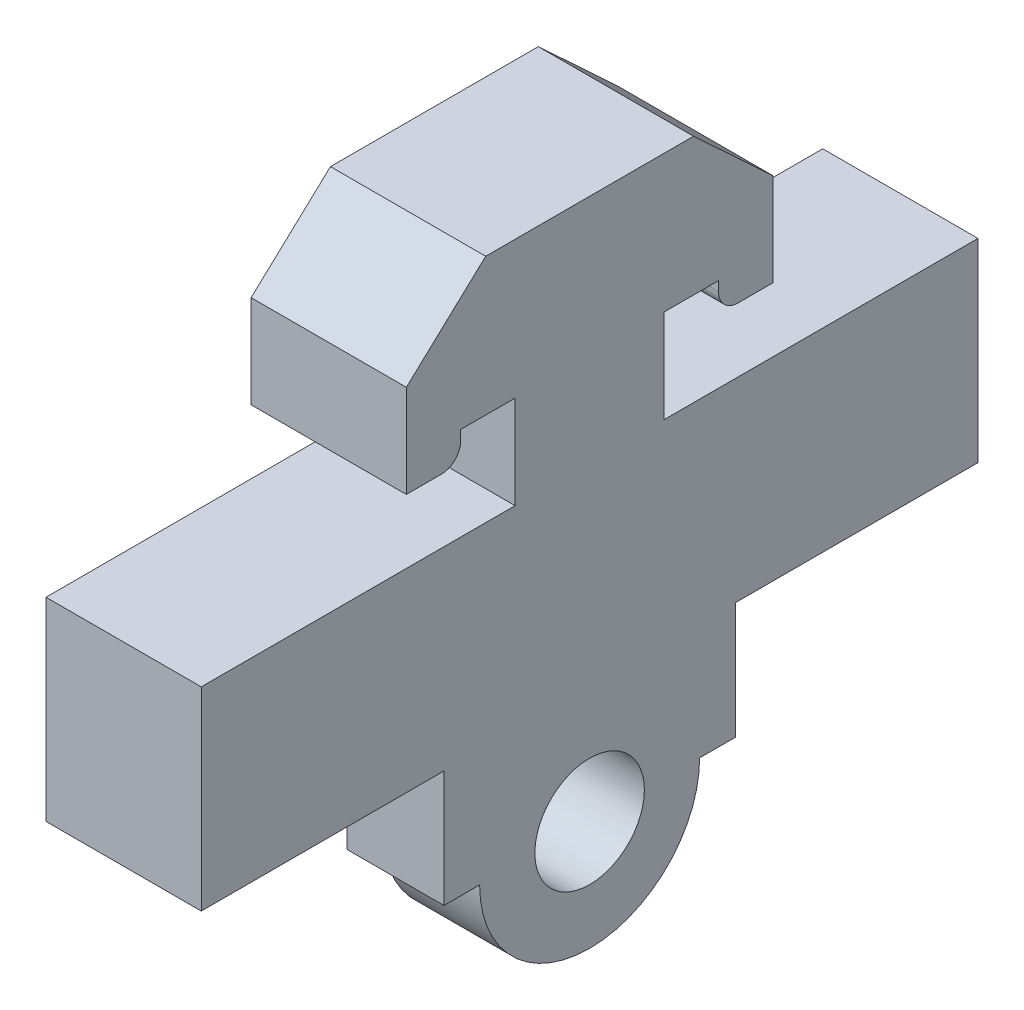
from build123d import *

# Parameters (mm, degrees)
SKETCH1_W           = 75
SKETCH1_H           = 40
BOSS_EXTRUDE1_DEPTH = 10
BOSS_EXTRUDE2_DEPTH = 5
BOSS_EXTRUDE3_DEPTH = 85
SKETCH4_W           = 77.004900299
SKETCH4_H           = 40
CUT_EXTRUDE1_DEPTH  = 72


with BuildPart() as part:
    # Sketch1 → Boss-Extrude1 (new body)
    with BuildSketch(Plane(origin=(0, 0, 0), x_dir=(1, 0, 0), z_dir=(0, 1, 0))):
        Rectangle(SKETCH1_W, SKETCH1_H)
    extrude(amount=BOSS_EXTRUDE1_DEPTH)

    # Sketch2 → Boss-Extrude2 (add)
    # profile 1 of 2: a face of its own
    with BuildSketch(Plane(origin=(37.5, 0, 0), x_dir=(0, 0, -1), z_dir=(1, 0, 0))):
        with BuildLine():
            Line((7.5, 0), (-7.5, 0))
            Line((-7.5, 0), (-7.5, -6))
            Line((-7.5, -6), (-5.665, -6))
            ThreePointArc((-5.665, -6), (0, -11.665), (5.665, -6))
            Line((5.665, -6), (7.5, -6))
            Line((7.5, -6), (7.5, 0))
        make_face()
        with BuildLine():
            ThreePointArc((2.82, -6), (0, -8.82), (-2.82, -6))
            ThreePointArc((-2.82, -6), (0, -3.18), (2.82, -6))
        make_face(mode=Mode.SUBTRACT)
    # profile 2 of 2: a face of its own
    with BuildSketch(Plane(origin=(37.5, 0, 0), x_dir=(0, 0, -1), z_dir=(1, 0, 0))):
        Polygon((-20, 0), (-7.5, 0), (7.5, 0), (20, 0), (20, 10), (-20, 10), align=None)
    boss_extrude2 = extrude(amount=BOSS_EXTRUDE2_DEPTH)

    # Mirror1: Boss-Extrude2 across plane
    add(boss_extrude2.mirror(Plane(origin=(0, 0, 0), x_dir=(0, 0, 1), z_dir=(1, 0, 0))))

    # Sketch3 → Boss-Extrude3 (add)
    with BuildSketch(Plane.ZY.offset(42.5)):
        with BuildLine():
            Line((-3.838227356, 14.8), (-3.838227356, 10))
            Line((-3.838227356, 10), (3.838227356, 10))
            Line((3.838227356, 10), (3.838227356, 14.8))
            Line((3.838227356, 14.8), (6.638227356, 14.8))
            Line((6.638227356, 14.8), (6.638227356, 14.3))
            ThreePointArc((6.638227356, 14.3), (6.931120575, 13.592893219), (7.638227356, 13.3))
            Line((7.638227356, 13.3), (9.438227356, 13.3))
            Line((9.438227356, 13.3), (9.438227356, 14.8))
            Line((9.438227356, 14.8), (9.438227356, 18.08))
            Line((9.438227356, 18.08), (5.3521045, 21.88))
            Line((5.3521045, 21.88), (-5.3521045, 21.88))
            Line((-5.3521045, 21.88), (-9.438227356, 18.08))
            Line((-9.438227356, 18.08), (-9.438227356, 14.8))
            Line((-9.438227356, 14.8), (-9.438227356, 13.3))
            Line((-9.438227356, 13.3), (-7.638227356, 13.3))
            ThreePointArc((-7.638227356, 13.3), (-6.931120575, 13.592893219), (-6.638227356, 14.3))
            Line((-6.638227356, 14.3), (-6.638227356, 14.8))
            Line((-6.638227356, 14.8), (-3.838227356, 14.8))
        make_face()
    extrude(amount=-BOSS_EXTRUDE3_DEPTH)

    # Sketch4 → Cut-Extrude1 (cut)
    with BuildSketch(Plane(origin=(0, 21.88, 0), x_dir=(1, 0, 0), z_dir=(0, 1, 0))):
        with Locations((-3.997549851, 0)):
            Rectangle(SKETCH4_W, SKETCH4_H)
    extrude(amount=-CUT_EXTRUDE1_DEPTH, mode=Mode.SUBTRACT)


solid = part.part
